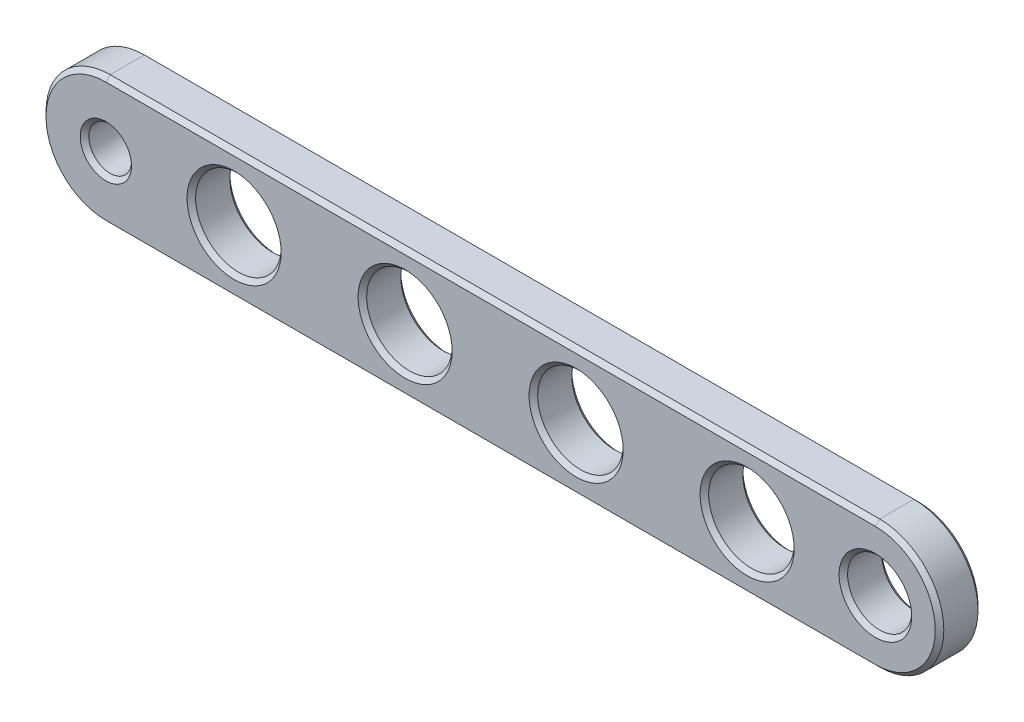
from build123d import *

# Parameters (mm, degrees)
SKETCH1_R           = 1
SKETCH1_R_2         = 1.5
SKETCH1_R_3         = 2
BOSS_EXTRUDE1_DEPTH = 2
CHAMFER3_SIZE       = 0.2


with BuildPart() as part:
    # Sketch1 → Boss-Extrude1 (new body)
    with BuildSketch(Plane.XY):
        with BuildLine():
            Line((-18, 3), (18, 3))
            ThreePointArc((18, 3), (21, 0), (18, -3))
            Line((18, -3), (-18, -3))
            ThreePointArc((-18, -3), (-21, 0), (-18, 3))
        make_face()
        with Locations((-18, 0)):
            Circle(SKETCH1_R, mode=Mode.SUBTRACT)
        with Locations((18, 0)):
            Circle(SKETCH1_R_2, mode=Mode.SUBTRACT)
        with Locations((12, 0)):
            Circle(SKETCH1_R_3, mode=Mode.SUBTRACT)
        with Locations((4, 0)):
            Circle(SKETCH1_R_3, mode=Mode.SUBTRACT)
        with Locations((-4, 0)):
            Circle(SKETCH1_R_3, mode=Mode.SUBTRACT)
        with Locations((-12, 0)):
            Circle(SKETCH1_R_3, mode=Mode.SUBTRACT)
    extrude(amount=BOSS_EXTRUDE1_DEPTH)

    # Chamfer3
    chamfer3_edges = [part.edges().sort_by_distance(p)[0] for p in [
        (-19, 0, 0),
        (-19, 0, 2),
        (21, 0, 2),
        (16.5, 0, 0),
        (16.5, 0, 2),
        (0, 3, 2),
        (10, 0, 0),
        (10, 0, 2),
        (2, 0, 0),
        (2, 0, 2),
        (-6, 0, 0),
        (-6, 0, 2),
        (-14, 0, 0),
        (-14, 0, 2),
        (-21, 0, 2),
        (0, 3, 0),
        (21, 0, 0),
        (0, -3, 0),
        (-21, 0, 0),
        (0, -3, 2),
    ]]
    chamfer(chamfer3_edges, length=CHAMFER3_SIZE)


solid = part.part
